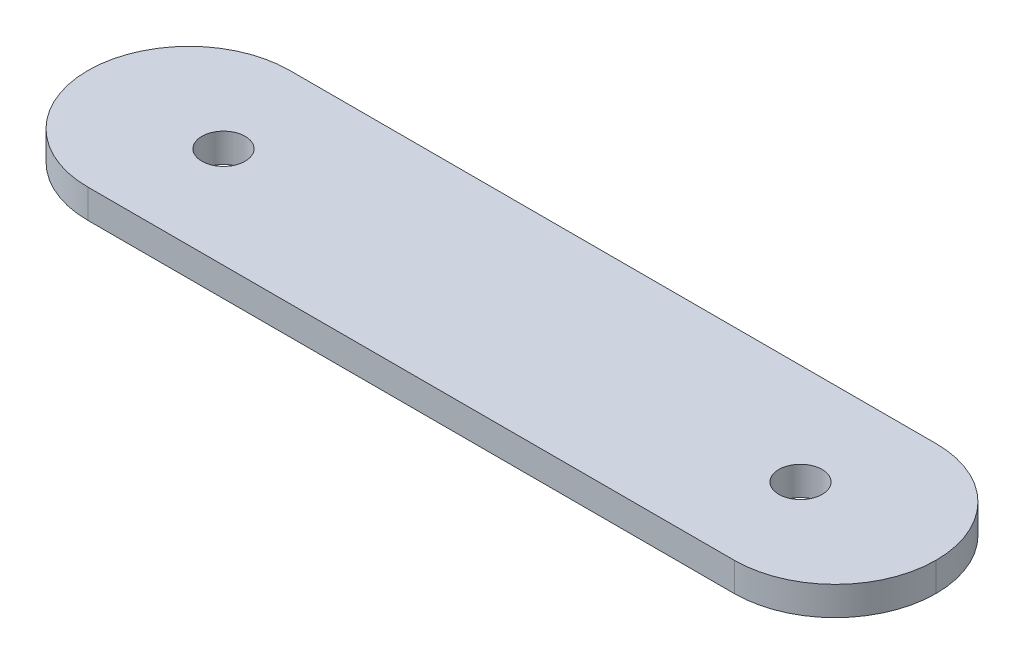
from build123d import *

# Parameters (mm, degrees)
SKETCH1_R           = 4.7625
BOSS_EXTRUDE1_DEPTH = 6.35


with BuildPart() as part:
    # Sketch1 → Boss-Extrude1 (new body)
    with BuildSketch(Plane(origin=(0, 0, 0), x_dir=(1, 0, 0), z_dir=(0, 1, 0))):
        with BuildLine():
            Line((-40.974554678, -18.198557696), (101.316245322, -18.198557696))
            ThreePointArc((101.316245322, -18.198557696), (117.013733021, -11.696445395), (123.515845322, 4.001042304))
            Line((123.515845322, 4.001042304), (123.515845322, 4.051842304))
            ThreePointArc((123.515845322, 4.051842304), (117.013733021, 19.749330004), (101.316245322, 26.251442304))
            Line((101.316245322, 26.251442304), (-40.974554678, 26.251442304))
            ThreePointArc((-40.974554678, 26.251442304), (-56.672042378, 19.749330004), (-63.174154678, 4.051842304))
            Line((-63.174154678, 4.051842304), (-63.174154678, 4.001042304))
            ThreePointArc((-63.174154678, 4.001042304), (-56.672042378, -11.696445395), (-40.974554678, -18.198557696))
        make_face()
        with Locations(Location((-33.329154678, 4.026442304, 0), (0, 0, 270))):
            Circle(SKETCH1_R, mode=Mode.SUBTRACT)
        with Locations(Location((93.670845322, 4.026442304, 0), (0, 0, 270))):
            Circle(SKETCH1_R, mode=Mode.SUBTRACT)
    extrude(amount=BOSS_EXTRUDE1_DEPTH)


solid = part.part
